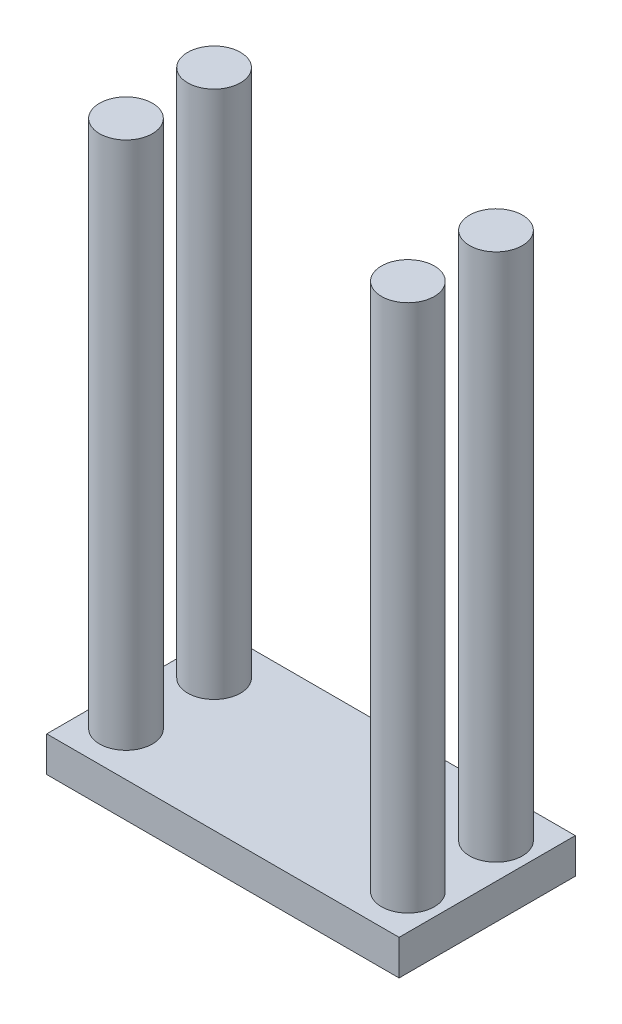
from build123d import *

# Parameters (mm, degrees)
SKETCH_1_W      = 20
SKETCH_1_H      = 5
EXTRUDE_2_DEPTH = 2
SKETCH_4_R      = 1.5
EXTRUDE_3_DEPTH = 30


with BuildPart() as part:
    # 草图1 → 凸台-拉伸2 (new body)
    with BuildSketch(Plane(origin=(0, 0, 0), x_dir=(1, 0, 0), z_dir=(0, 1, 0))):
        Rectangle(SKETCH_1_W, SKETCH_1_H)
    extrude_2 = extrude(amount=-EXTRUDE_2_DEPTH)

    # 草图4 → 凸台-拉伸3 (add)
    with BuildSketch(Plane(origin=(0, 0, 0), x_dir=(1, 0, 0), z_dir=(0, 1, 0))):
        with Locations(Location((-8, 0, 0), (0, 0, 270))):
            Circle(SKETCH_4_R)
        with Locations(Location((8, 0, 0), (0, 0, 90))):
            Circle(SKETCH_4_R)
    extrude_3 = extrude(amount=EXTRUDE_3_DEPTH)

    # 镜向1: 凸台-拉伸2, 凸台-拉伸3 across plane
    add(extrude_2.mirror(Plane(origin=(0, 0, -2.5), x_dir=(1, 0, 0), z_dir=(0, 0, -1))))
    add(extrude_3.mirror(Plane(origin=(0, 0, -2.5), x_dir=(1, 0, 0), z_dir=(0, 0, -1))))


solid = part.part
